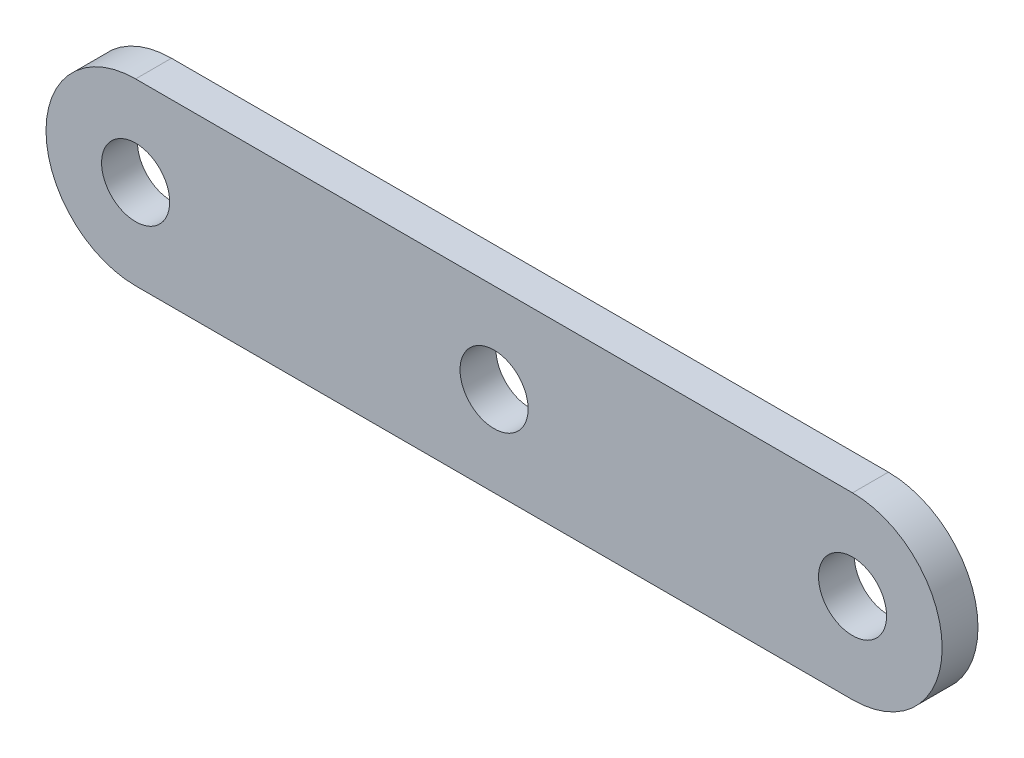
from build123d import *

# Parameters (mm, degrees)
SALIENTE_EXTRUIR1_DEPTH = 1.27
CROQUIS2_R              = 2.413
CORTAR_EXTRUIR1_DEPTH   = 57.005345997
MATRIZL1_COUNT          = 3
MATRIZL1_PITCH          = 25.4


with BuildPart() as part:
    # Croquis1 → Saliente-Extruir1 (new, symmetric)
    with BuildSketch(Plane.XY):
        with BuildLine():
            Line((48.26, -12.161212121), (-2.54, -12.161212121))
            ThreePointArc((-2.54, -12.161212121), (-8.89, -5.811212121), (-2.54, 0.538787879))
            Line((-2.54, 0.538787879), (48.26, 0.538787879))
            ThreePointArc((48.26, 0.538787879), (54.61, -5.811212121), (48.26, -12.161212121))
        make_face()
    extrude(amount=SALIENTE_EXTRUIR1_DEPTH, both=True)

    # Croquis2 → Cortar-Extruir1 (cut, through all)
    with BuildSketch(Plane.XY.offset(1.27)):
        with Locations((-2.54, -5.811212121)):
            Circle(CROQUIS2_R)
    cortar_extruir1 = extrude(amount=-CORTAR_EXTRUIR1_DEPTH, mode=Mode.SUBTRACT)

    # MatrizL1: Cortar-Extruir1 ×3
    with Locations(*[(i * MATRIZL1_PITCH, 0, 0) for i in range(1, MATRIZL1_COUNT)]):
        add(cortar_extruir1, mode=Mode.SUBTRACT)


solid = part.part
